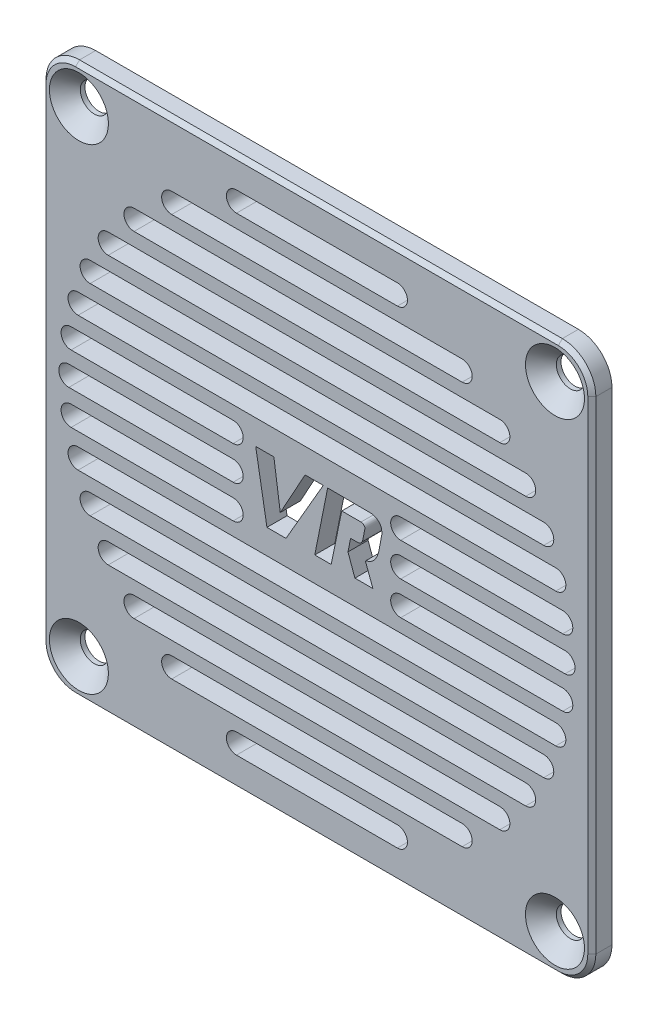
from build123d import *

# Parameters (mm, degrees)
SKETCH1_R           = 2.1
BASE_DEPTH          = 3
SCREWCHAMFER_SIZE   = 2.3
LOGO_DEPTH          = 59.060313468
SLOTS_DEPTH         = 59.060313614
OUTSIDECHAMFER_SIZE = 0.6


with BuildPart() as part:
    # Sketch1 → Base (new body)
    with BuildSketch(Plane.XY):
        with BuildLine():
            Line((41, 36), (41, -36))
            ThreePointArc((41, -36), (39.535533906, -39.535533906), (36, -41))
            Line((36, -41), (-36, -41))
            ThreePointArc((-36, -41), (-39.535533906, -39.535533906), (-41, -36))
            Line((-41, -36), (-41, 36))
            ThreePointArc((-41, 36), (-39.535533906, 39.535533906), (-36, 41))
            Line((-36, 41), (36, 41))
            ThreePointArc((36, 41), (39.535533906, 39.535533906), (41, 36))
        make_face()
        with Locations((35.5, -35.5)):
            Circle(SKETCH1_R, mode=Mode.SUBTRACT)
        with Locations((-35.5, -35.5)):
            Circle(SKETCH1_R, mode=Mode.SUBTRACT)
        with Locations((-35.5, 35.5)):
            Circle(SKETCH1_R, mode=Mode.SUBTRACT)
        with Locations((35.5, 35.5)):
            Circle(SKETCH1_R, mode=Mode.SUBTRACT)
    extrude(amount=BASE_DEPTH)

    # ScrewChamfer
    screwchamfer_edges = [part.edges().sort_by_distance(p)[0] for p in [
        (-37.6, -35.5, 3),
        (-37.6, 35.5, 3),
        (33.4, 35.5, 3),
        (33.4, -35.5, 3),
    ]]
    chamfer(screwchamfer_edges, length=SCREWCHAMFER_SIZE)

    # Sketch3 → Logo (cut, through all)
    with BuildSketch(Plane.XY.offset(3)):
        Polygon((0.943772225, 4.807339306), (-1.770278146, 4.807339306), (-5.467106691, -1.899839555), (-6.421148406, 4.807339306), (-9.131384374, 4.807339306), (-7.454751896, -4.81111301), (-4.6161142, -4.81111301), align=None)
        with BuildLine():
            Line((3.703527881, 2.889834342), (6.573462709, 2.889834342))
            add(Edge.make_bspline(
                [(6.573462709, 2.889834342), (6.639918683, 2.878954155), (6.706374657, 2.868073967), (6.772830631, 2.857193779), (6.786633549, 2.854933962), (6.814239384, 2.850414328), (6.855551453, 2.832372294), (6.876790416, 2.814167468), (6.887409897, 2.805065055), (6.919492092, 2.777566032), (6.951574286, 2.750067008), (6.983656481, 2.722567984), (6.993167085, 2.714416037), (7.012188295, 2.698112144), (7.038593103, 2.66998605), (7.051500973, 2.648514901), (7.057954908, 2.637779327), (7.075404999, 2.60875258), (7.092855089, 2.579725832), (7.11030518, 2.550699085), (7.116791727, 2.539909264), (7.12976482, 2.518329621), (7.136480315, 2.478226939), (7.136480315, 2.453047938), (7.136480315, 2.440458437), (7.136480315, 2.395991418), (7.136480315, 2.3515244), (7.136480315, 2.307057382), (7.136480315, 2.292302161), (7.136480315, 2.262791718), (7.132234446, 2.218327427), (7.1266495, 2.189350288), (7.123857028, 2.174861718), (7.033719, 1.707186218), (6.943580973, 1.239510717), (6.853442946, 0.771835216), (6.850303902, 0.755548486), (6.844025815, 0.722975025), (6.831361308, 0.674631499), (6.820862573, 0.643163717), (6.815613205, 0.627429826), (6.799830938, 0.580125754), (6.784048672, 0.532821683), (6.768266405, 0.485517611), (6.763799932, 0.472130285), (6.754866986, 0.445355633), (6.73663685, 0.405279323), (6.71826793, 0.383848917), (6.70908347, 0.373133714), (6.685410448, 0.345515187), (6.661737425, 0.317896661), (6.638064403, 0.290278135), (6.630063422, 0.280943658), (6.614061462, 0.262274704), (6.587939681, 0.235980407), (6.569486158, 0.219730482), (6.560259397, 0.21160552), (6.532062416, 0.186775636), (6.503865435, 0.161945752), (6.475668454, 0.137115868), (6.465349713, 0.128029323), (6.44471223, 0.109856232), (6.406036938, 0.091012836), (6.379877632, 0.08253595), (6.366797978, 0.078297507), (6.300222974, 0.05672397), (6.23364797, 0.035150434), (6.167072966, 0.013576897)],
                knots=[0, 0, 0, 0, 0.0565978, 0.0565978, 0.0565978, 0.068353174, 0.080108547, 0.09186392, 0.09186392, 0.09186392, 0.127377722, 0.127377722, 0.127377722, 0.13790561, 0.148433497, 0.158961384, 0.158961384, 0.158961384, 0.18742659, 0.18742659, 0.18742659, 0.198007674, 0.208588759, 0.219169844, 0.219169844, 0.219169844, 0.256542993, 0.256542993, 0.256542993, 0.268944298, 0.281345604, 0.29374691, 0.29374691, 0.29374691, 0.694047762, 0.694047762, 0.694047762, 0.70798818, 0.721928599, 0.735869017, 0.735869017, 0.735869017, 0.777780999, 0.777780999, 0.777780999, 0.789642332, 0.801503665, 0.813364999, 0.813364999, 0.813364999, 0.843937685, 0.843937685, 0.843937685, 0.854270606, 0.864603526, 0.874936447, 0.874936447, 0.874936447, 0.90651385, 0.90651385, 0.90651385, 0.918069663, 0.929625477, 0.94118129, 0.94118129, 0.94118129, 1, 1, 1, 1], degree=3))
            Line((6.167072966, 0.013576897), (5.021039356, 0.013576897))
            Line((5.021039356, 0.013576897), (4.631352863, -1.934855565))
            Line((4.631352863, -1.934855565), (5.663053903, -4.81111301))
            Line((5.663053903, -4.81111301), (8.342652792, -4.81111301))
            Line((8.342652792, -4.81111301), (7.229262814, -1.811145568))
            add(Edge.make_bspline(
                [(9.229165365, 0.414561503), (9.120168623, 0.017200275), (8.915302455, -0.554839168), (8.44639111, -1.160174748), (7.942619292, -1.563122791), (7.499335661, -1.705024341), (7.229262814, -1.811145568)],
                knots=[0, 0, 0, 0, 0.394088826, 0.566272378, 0.72213611, 1, 1, 1, 1], degree=3))
            Line((9.229165365, 0.414561503), (9.678442486, 2.846313591))
            add(Edge.make_bspline(
                [(9.678442486, 2.846313591), (9.687044519, 2.989216011), (9.687308007, 3.219249114), (9.634056055, 3.573555205), (9.530960339, 3.877016599), (9.318991652, 4.174966565), (9.058914286, 4.416757541), (8.748200867, 4.611244982), (8.404818025, 4.732990617), (8.163573675, 4.770595689), (8.033377798, 4.776411806)],
                knots=[0, 0, 0, 0, 0.150297951, 0.240095534, 0.375313148, 0.481557048, 0.620389709, 0.745312315, 0.863340897, 1, 1, 1, 1], degree=3))
            Line((8.033377798, 4.776411806), (1.600457921, 4.807339306))
            Line((1.600457921, 4.807339306), (-0.323232542, -4.81111301))
            Line((-0.323232542, -4.81111301), (2.126225411, -4.81111301))
            Line((2.126225411, -4.81111301), (3.703527881, 2.889834342))
        make_face()
    extrude(amount=-LOGO_DEPTH, mode=Mode.SUBTRACT)

    # Sketch4 → Slots (cut, through all)
    with BuildSketch(Plane.XY.offset(3)):
        with BuildLine():
            Line((-33.823069051, 16.5), (33.823069051, 16.5))
            ThreePointArc((33.823069051, 16.5), (35.323069051, 15), (33.823069051, 13.5))
            Line((33.823069051, 13.5), (-33.823069051, 13.5))
            ThreePointArc((-33.823069051, 13.5), (-35.323069051, 15), (-33.823069051, 16.5))
        make_face()
        with BuildLine():
            Line((-35.623026261, 11.5), (35.623026261, 11.5))
            ThreePointArc((35.623026261, 11.5), (37.123026261, 10), (35.623026261, 8.5))
            Line((35.623026261, 8.5), (-35.623026261, 8.5))
            ThreePointArc((-35.623026261, 8.5), (-37.123026261, 10), (-35.623026261, 11.5))
        make_face()
        with BuildLine():
            Line((-33.823069051, -13.5), (33.823069051, -13.5))
            ThreePointArc((33.823069051, -13.5), (35.323069051, -15), (33.823069051, -16.5))
            Line((33.823069051, -16.5), (-33.823069051, -16.5))
            ThreePointArc((-33.823069051, -16.5), (-35.323069051, -15), (-33.823069051, -13.5))
        make_face()
        with BuildLine():
            Line((-35.623026261, -8.5), (35.623026261, -8.5))
            ThreePointArc((35.623026261, -8.5), (37.123026261, -10), (35.623026261, -11.5))
            Line((35.623026261, -11.5), (-35.623026261, -11.5))
            ThreePointArc((-35.623026261, -11.5), (-37.123026261, -10), (-35.623026261, -8.5))
        make_face()
        with BuildLine():
            Line((12.5, 6.5), (36.66060556, 6.5))
            ThreePointArc((36.66060556, 6.5), (38.16060556, 5), (36.66060556, 3.5))
            Line((36.66060556, 3.5), (12.5, 3.5))
            ThreePointArc((12.5, 3.5), (11, 5), (12.5, 6.5))
        make_face()
        with BuildLine():
            Line((12.5, -3.5), (36.66060556, -3.5))
            ThreePointArc((36.66060556, -3.5), (38.16060556, -5), (36.66060556, -6.5))
            Line((36.66060556, -6.5), (12.5, -6.5))
            ThreePointArc((12.5, -6.5), (11, -5), (12.5, -3.5))
        make_face()
        with BuildLine():
            Line((-36.66060556, 6.5), (-12.5, 6.5))
            ThreePointArc((-12.5, 6.5), (-11, 5), (-12.5, 3.5))
            Line((-12.5, 3.5), (-36.66060556, 3.5))
            ThreePointArc((-36.66060556, 3.5), (-38.16060556, 5), (-36.66060556, 6.5))
        make_face()
        with BuildLine():
            Line((-36.66060556, -3.5), (-12.5, -3.5))
            ThreePointArc((-12.5, -3.5), (-11, -5), (-12.5, -6.5))
            Line((-12.5, -6.5), (-36.66060556, -6.5))
            ThreePointArc((-36.66060556, -6.5), (-38.16060556, -5), (-36.66060556, -3.5))
        make_face()
        with BuildLine():
            Line((-37, 1.5), (-12.5, 1.5))
            ThreePointArc((-12.5, 1.5), (-11, 0), (-12.5, -1.5))
            Line((-12.5, -1.5), (-37, -1.5))
            ThreePointArc((-37, -1.5), (-38.5, 0), (-37, 1.5))
        make_face()
        with BuildLine():
            Line((12.5, 1.5), (37, 1.5))
            ThreePointArc((37, 1.5), (38.5, 0), (37, -1.5))
            Line((37, -1.5), (12.5, -1.5))
            ThreePointArc((12.5, -1.5), (11, 0), (12.5, 1.5))
        make_face()
        with BuildLine():
            Line((-31.128764833, 21.5), (31.128764833, 21.5))
            ThreePointArc((31.128764833, 21.5), (32.628764833, 20), (31.128764833, 18.5))
            Line((31.128764833, 18.5), (-31.128764833, 18.5))
            ThreePointArc((-31.128764833, 18.5), (-32.628764833, 20), (-31.128764833, 21.5))
        make_face()
        with BuildLine():
            Line((-27.276363394, 26.5), (27.276363394, 26.5))
            ThreePointArc((27.276363394, 26.5), (28.776363394, 25), (27.276363394, 23.5))
            Line((27.276363394, 23.5), (-27.276363394, 23.5))
            ThreePointArc((-27.276363394, 23.5), (-28.776363394, 25), (-27.276363394, 26.5))
        make_face()
        with BuildLine():
            Line((-21.656407828, 31.5), (21.656407828, 31.5))
            ThreePointArc((21.656407828, 31.5), (23.156407828, 30), (21.656407828, 28.5))
            Line((21.656407828, 28.5), (-21.656407828, 28.5))
            ThreePointArc((-21.656407828, 28.5), (-23.156407828, 30), (-21.656407828, 31.5))
        make_face()
        with BuildLine():
            Line((-12, 36.5), (12, 36.5))
            ThreePointArc((12, 36.5), (13.5, 35), (12, 33.5))
            Line((12, 33.5), (-12, 33.5))
            ThreePointArc((-12, 33.5), (-13.5, 35), (-12, 36.5))
        make_face()
        with BuildLine():
            Line((-31.128764833, -21.5), (31.128764833, -21.5))
            ThreePointArc((31.128764833, -21.5), (32.628764833, -20), (31.128764833, -18.5))
            Line((31.128764833, -18.5), (-31.128764833, -18.5))
            ThreePointArc((-31.128764833, -18.5), (-32.628764833, -20), (-31.128764833, -21.5))
        make_face()
        with BuildLine():
            Line((-27.276363394, -26.5), (27.276363394, -26.5))
            ThreePointArc((27.276363394, -26.5), (28.776363394, -25), (27.276363394, -23.5))
            Line((27.276363394, -23.5), (-27.276363394, -23.5))
            ThreePointArc((-27.276363394, -23.5), (-28.776363394, -25), (-27.276363394, -26.5))
        make_face()
        with BuildLine():
            Line((-21.656407828, -31.5), (21.656407828, -31.5))
            ThreePointArc((21.656407828, -31.5), (23.156407828, -30), (21.656407828, -28.5))
            Line((21.656407828, -28.5), (-21.656407828, -28.5))
            ThreePointArc((-21.656407828, -28.5), (-23.156407828, -30), (-21.656407828, -31.5))
        make_face()
        with BuildLine():
            Line((-12, -36.5), (12, -36.5))
            ThreePointArc((12, -36.5), (13.5, -35), (12, -33.5))
            Line((12, -33.5), (-12, -33.5))
            ThreePointArc((-12, -33.5), (-13.5, -35), (-12, -36.5))
        make_face()
    extrude(amount=-SLOTS_DEPTH, mode=Mode.SUBTRACT)

    # OutsideChamfer
    outsidechamfer_edges = [part.edges().sort_by_distance(p)[0] for p in [
        (0, 41, 3),
        (-39.535533906, 39.535533906, 3),
        (-41, 0, 3),
        (-39.535533906, -39.535533906, 3),
        (0, -41, 3),
        (39.535533906, -39.535533906, 3),
        (41, 0, 3),
        (39.535533906, 39.535533906, 3),
    ]]
    chamfer(outsidechamfer_edges, length=OUTSIDECHAMFER_SIZE)


solid = part.part
